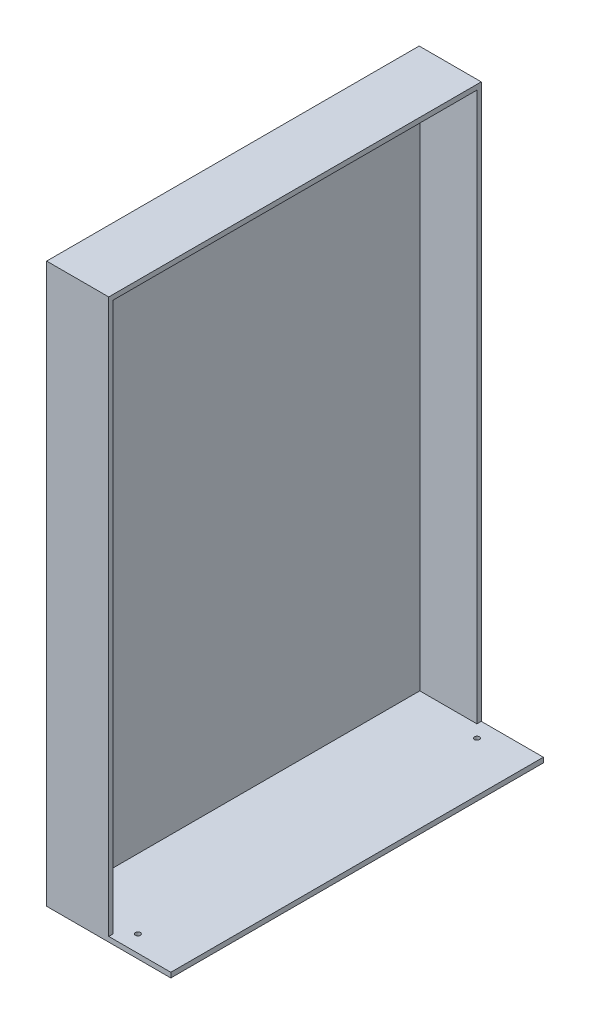
from build123d import *

# Parameters (mm, degrees)
SKETCH_1_W            = 100
SKETCH_1_H            = 300
EXTRUDE_1_DEPTH       = 4
EXTRUDE_2_DEPTH       = 442
SKETCH_3_W            = 50
SKETCH_3_H            = 300
EXTRUDE_3_DEPTH       = 4
HOLE_WIZARD_4_0_4_1_D = 4


with BuildPart() as part:
    # 草图1 → 凸台-拉伸1 (new body)
    with BuildSketch(Plane(origin=(0, 0, 0), x_dir=(1, 0, 0), z_dir=(0, 1, 0))):
        with Locations((50, 150)):
            Rectangle(SKETCH_1_W, SKETCH_1_H)
    extrude(amount=EXTRUDE_1_DEPTH)

    # 草图2 → 凸台-拉伸2 (add)
    with BuildSketch(Plane(origin=(0, 4, 0), x_dir=(1, 0, 0), z_dir=(0, 1, 0))):
        Polygon((0, 0), (8.236039078, 0), (50, 0), (50, 3.5), (4, 3.5), (4, 296.5), (50, 296.5), (50, 300), (8.236039078, 300), (0, 300), align=None)
    extrude(amount=EXTRUDE_2_DEPTH)

    # 草图3 → 凸台-拉伸3 (add)
    with BuildSketch(Plane(origin=(0, 446, 0), x_dir=(1, 0, 0), z_dir=(0, 1, 0))):
        with Locations((25, 150)):
            Rectangle(SKETCH_3_W, SKETCH_3_H)
    extrude(amount=EXTRUDE_3_DEPTH)

    # Ø4.0 (4) 直径孔1 (through all)
    with Locations(Plane(origin=(0, 0, 0), x_dir=(-1, 0, 0), z_dir=(0, -1, 0))):
        with Locations((-60, 13.5), (-60, 286.5)):
            Hole(HOLE_WIZARD_4_0_4_1_D / 2)


solid = part.part
